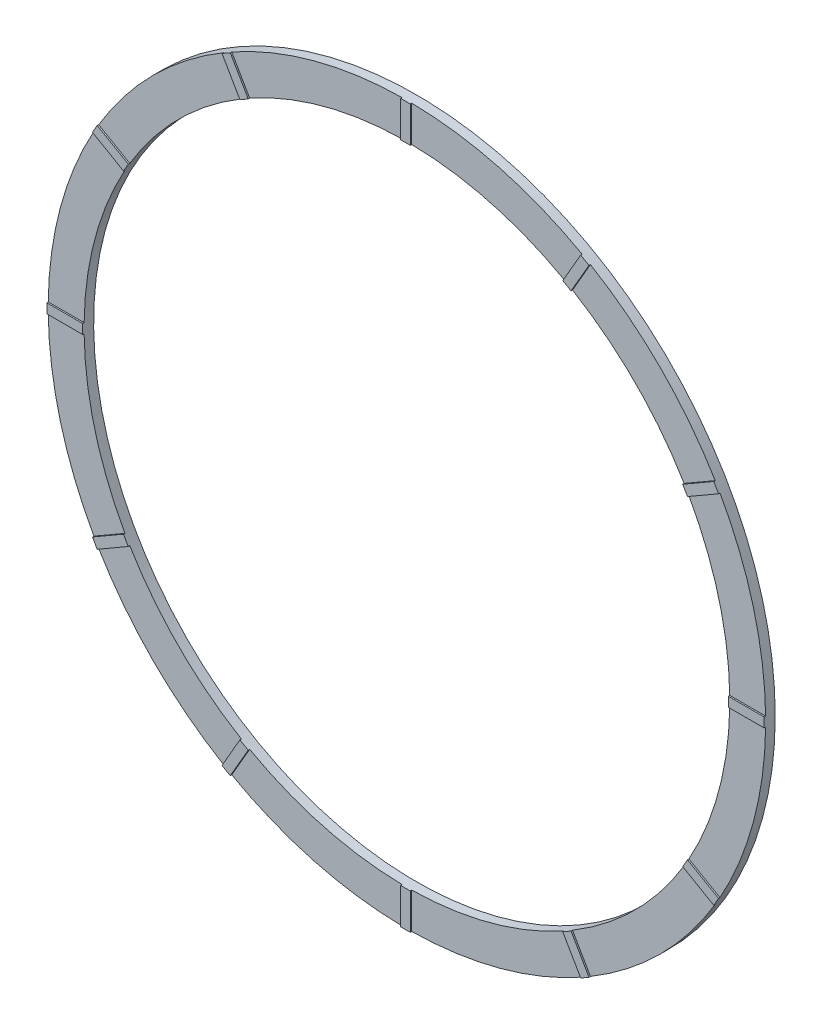
from build123d import *
from build123d.topology import SkipClean

# Parameters (mm, degrees)
SKETCH1_R           = 7.5
SKETCH1_R_2         = 6.75
BOSS_EXTRUDE1_DEPTH = 0.2
BOSS_EXTRUDE3_DEPTH = 0.03


with BuildPart() as part:
    # Sketch1 → Boss-Extrude1 (new body)
    with BuildSketch(Plane.XY):
        Circle(SKETCH1_R)
        Circle(SKETCH1_R_2, mode=Mode.SUBTRACT)
    extrude(amount=BOSS_EXTRUDE1_DEPTH)

    # Sketch2 → Boss-Extrude3 (add)
    with SkipClean():  # the faces are left unmerged after this step: merging them gives an invalid solid
        with BuildSketch(Plane.XY.offset(0.2)):
            with BuildLine():
                Line((3.663064111, 6.544613152), (3.288027069, 5.89502994))
                ThreePointArc((3.288027069, 5.89502994), (3.375, 5.845671476), (3.46123215, 5.79502994))
                Line((3.46123215, 5.79502994), (3.836269192, 6.444613152))
                ThreePointArc((3.836269192, 6.444613152), (3.75, 6.495190528), (3.663064111, 6.544613152))
            make_face()
            with BuildLine():
                Line((-0.1, 7.499333304), (-0.1, 6.749259219))
                ThreePointArc((-0.1, 6.749259219), (0, 6.75), (0.1, 6.749259219))
                Line((0.1, 6.749259219), (0.1, 7.499333304))
                ThreePointArc((0.1, 7.499333304), (0, 7.5), (-0.1, 7.499333304))
            make_face()
            with BuildLine():
                Line((6.444613152, 3.836269192), (5.79502994, 3.46123215))
                ThreePointArc((5.79502994, 3.46123215), (5.845671476, 3.375), (5.89502994, 3.288027069))
                Line((5.89502994, 3.288027069), (6.544613152, 3.663064111))
                ThreePointArc((6.544613152, 3.663064111), (6.495190528, 3.75), (6.444613152, 3.836269192))
            make_face()
            with BuildLine():
                Line((7.499333304, 0.1), (6.749259219, 0.1))
                ThreePointArc((6.749259219, 0.1), (6.75, 0), (6.749259219, -0.1))
                Line((6.749259219, -0.1), (7.499333304, -0.1))
                ThreePointArc((7.499333304, -0.1), (7.5, 0), (7.499333304, 0.1))
            make_face()
            with BuildLine():
                Line((6.544613152, -3.663064111), (5.89502994, -3.288027069))
                ThreePointArc((5.89502994, -3.288027069), (5.845671476, -3.375), (5.79502994, -3.46123215))
                Line((5.79502994, -3.46123215), (6.444613152, -3.836269192))
                ThreePointArc((6.444613152, -3.836269192), (6.495190528, -3.75), (6.544613152, -3.663064111))
            make_face()
            with BuildLine():
                Line((3.836269192, -6.444613152), (3.46123215, -5.79502994))
                ThreePointArc((3.46123215, -5.79502994), (3.375, -5.845671476), (3.288027069, -5.89502994))
                Line((3.288027069, -5.89502994), (3.663064111, -6.544613152))
                ThreePointArc((3.663064111, -6.544613152), (3.75, -6.495190528), (3.836269192, -6.444613152))
            make_face()
            with BuildLine():
                Line((0.1, -7.499333304), (0.1, -6.749259219))
                ThreePointArc((0.1, -6.749259219), (0, -6.75), (-0.1, -6.749259219))
                Line((-0.1, -6.749259219), (-0.1, -7.499333304))
                ThreePointArc((-0.1, -7.499333304), (0, -7.5), (0.1, -7.499333304))
            make_face()
            with BuildLine():
                Line((-3.663064111, -6.544613152), (-3.288027069, -5.89502994))
                ThreePointArc((-3.288027069, -5.89502994), (-3.375, -5.845671476), (-3.46123215, -5.79502994))
                Line((-3.46123215, -5.79502994), (-3.836269192, -6.444613152))
                ThreePointArc((-3.836269192, -6.444613152), (-3.75, -6.495190528), (-3.663064111, -6.544613152))
            make_face()
            with BuildLine():
                Line((-6.444613152, -3.836269192), (-5.79502994, -3.46123215))
                ThreePointArc((-5.79502994, -3.46123215), (-5.845671476, -3.375), (-5.89502994, -3.288027069))
                Line((-5.89502994, -3.288027069), (-6.544613152, -3.663064111))
                ThreePointArc((-6.544613152, -3.663064111), (-6.495190528, -3.75), (-6.444613152, -3.836269192))
            make_face()
            with BuildLine():
                Line((-7.499333304, -0.1), (-6.749259219, -0.1))
                ThreePointArc((-6.749259219, -0.1), (-6.75, 0), (-6.749259219, 0.1))
                Line((-6.749259219, 0.1), (-7.499333304, 0.1))
                ThreePointArc((-7.499333304, 0.1), (-7.5, 0), (-7.499333304, -0.1))
            make_face()
            with BuildLine():
                Line((-6.544613152, 3.663064111), (-5.89502994, 3.288027069))
                ThreePointArc((-5.89502994, 3.288027069), (-5.845671476, 3.375), (-5.79502994, 3.46123215))
                Line((-5.79502994, 3.46123215), (-6.444613152, 3.836269192))
                ThreePointArc((-6.444613152, 3.836269192), (-6.495190528, 3.75), (-6.544613152, 3.663064111))
            make_face()
            with BuildLine():
                Line((-3.836269192, 6.444613152), (-3.46123215, 5.79502994))
                ThreePointArc((-3.46123215, 5.79502994), (-3.375, 5.845671476), (-3.288027069, 5.89502994))
                Line((-3.288027069, 5.89502994), (-3.663064111, 6.544613152))
                ThreePointArc((-3.663064111, 6.544613152), (-3.75, 6.495190528), (-3.836269192, 6.444613152))
            make_face()
        extrude(amount=BOSS_EXTRUDE3_DEPTH)


solid = part.part
